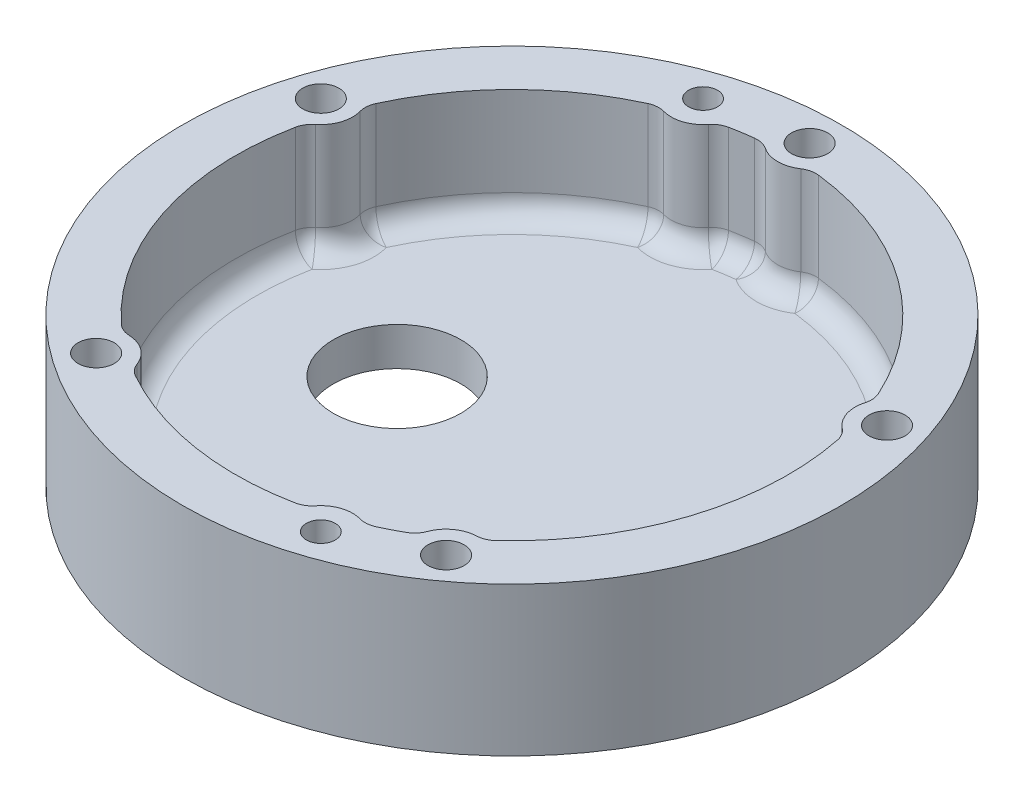
from build123d import *

# Parameters (mm, degrees)
SKETCH_1_R                = 77.5
EXTRUDE_1_DEPTH           = 35
HOLE_WIZARD_1_D           = 8.5
HOLE_WIZARD_1_CBORE_D     = 14
HOLE_WIZARD_1_CBORE_DEPTH = 9
PATTERN_CIRCULAR_1_COUNT  = 5
HOLE_WIZARD_M8_1_D        = 6.8
PATTERN_CIRCULAR_2_COUNT  = 2
CUT_EXTRUDE_1_DEPTH       = 26
FILLET_1_R                = 5
SKETCH_7_R                = 15
CUT_EXTRUDE_2_DEPTH       = 113.643242302


with BuildPart() as part:
    # 草图1 → 凸台-拉伸1 (new body)
    with BuildSketch(Plane(origin=(0, 0, 0), x_dir=(1, 0, 0), z_dir=(0, 1, 0))):
        with Locations(Location((0, 0, 0), (0, 0, 270))):
            Circle(SKETCH_1_R)
    extrude(amount=EXTRUDE_1_DEPTH)

    # 孔1 (through all)
    with Locations(Plane.XZ):
        with Locations((0, -70)):
            hole_wizard_1 = CounterBoreHole(HOLE_WIZARD_1_D / 2, HOLE_WIZARD_1_CBORE_D / 2, HOLE_WIZARD_1_CBORE_DEPTH)

    # 阵列(圆周)1: 孔1 ×5 about axis
    pattern_circular_1_axis = Axis((0, 0, 0), (0, 1, 0))
    for i in range(1, PATTERN_CIRCULAR_1_COUNT):
        add(hole_wizard_1.rotate(pattern_circular_1_axis, i * 360 / PATTERN_CIRCULAR_1_COUNT), mode=Mode.SUBTRACT)

    # M8 螺纹孔1 (through all)
    with Locations(Plane(origin=(0, 35, 0), x_dir=(1, 0, 0), z_dir=(0, 1, 0))):
        with Locations((-21.631189606, 66.573956141)):
            hole_wizard_m8_1 = Hole(HOLE_WIZARD_M8_1_D / 2)

    # 阵列(圆周)2: M8 螺纹孔1 ×2 about axis
    pattern_circular_2_axis = Axis((0, 0, 0), (0, 1, 0))
    for i in range(1, PATTERN_CIRCULAR_2_COUNT):
        add(hole_wizard_m8_1.rotate(pattern_circular_2_axis, i * 360 / PATTERN_CIRCULAR_2_COUNT), mode=Mode.SUBTRACT)

    # 草图6 → 切除-拉伸1 (cut)
    with BuildSketch(Plane(origin=(0, 35, 0), x_dir=(1, 0, 0), z_dir=(0, 1, 0))):
        with BuildLine():
            ThreePointArc((59.943194163, 25.135900093), (38.206041399, 52.586104634), (5.382195883, 64.776785714))
            ThreePointArc((5.382195883, 64.776785714), (0, 62.5), (-5.382195883, 64.776785714))
            ThreePointArc((-5.382195883, 64.776785714), (-10.168240228, 64.199742139), (-14.89835516, 63.269574153))
            ThreePointArc((-14.89835516, 63.269574153), (-19.313562148, 59.441032268), (-25.135900093, 59.943194163))
            ThreePointArc((-25.135900093, 59.943194163), (-45.961940777, 45.961940777), (-59.943194163, 25.135900093))
            ThreePointArc((-59.943194163, 25.135900093), (-59.441032268, 19.313562148), (-63.269574153, 14.89835516))
            ThreePointArc((-63.269574153, 14.89835516), (-61.818673559, -20.086104634), (-42.42912727, -49.241945119))
            ThreePointArc((-42.42912727, -49.241945119), (-36.736578268, -50.563562148), (-33.720551397, -55.569095849))
            ThreePointArc((-33.720551397, -55.569095849), (-10.168240228, -64.199742139), (14.89835516, -63.269574153))
            ThreePointArc((14.89835516, -63.269574153), (19.313562148, -59.441032268), (25.135900093, -59.943194163))
            ThreePointArc((25.135900093, -59.943194163), (29.509382483, -57.915424072), (33.720551397, -55.569095849))
            ThreePointArc((33.720551397, -55.569095849), (36.736578268, -50.563562148), (42.42912727, -49.241945119))
            ThreePointArc((42.42912727, -49.241945119), (61.818673559, -20.086104634), (63.269574153, 14.89835516))
            ThreePointArc((63.269574153, 14.89835516), (59.441032268, 19.313562148), (59.943194163, 25.135900093))
        make_face()
    extrude(amount=-CUT_EXTRUDE_1_DEPTH, mode=Mode.SUBTRACT)

    # 圆角1
    fillet_1_edges = [part.edges().sort_by_distance(p)[0] for p in [
        (-45.961940777, 9, -45.961940777),
        (-59.943194163, 22, -25.135900093),
        (-19.313562148, 9, -59.441032268),
        (-25.135900093, 22, -59.943194163),
        (-10.168240228, 9, -64.199742139),
        (-14.89835516, 22, -63.269574153),
        (0, 9, -62.5),
        (-5.382195883, 22, -64.776785714),
        (38.206041399, 9, -52.586104634),
        (5.382195883, 22, -64.776785714),
        (59.441032268, 9, -19.313562148),
        (59.943194163, 22, -25.135900093),
        (61.818673559, 9, 20.086104634),
        (63.269574153, 22, -14.89835516),
        (36.736578268, 9, 50.563562148),
        (42.42912727, 22, 49.241945119),
        (29.509382483, 9, 57.915424072),
        (33.720551397, 22, 55.569095849),
        (19.313562148, 9, 59.441032268),
        (25.135900093, 22, 59.943194163),
        (-10.168240228, 9, 64.199742139),
        (14.89835516, 22, 63.269574153),
        (-36.736578268, 9, 50.563562148),
        (-33.720551397, 22, 55.569095849),
        (-61.818673559, 9, 20.086104634),
        (-42.42912727, 22, 49.241945119),
        (-59.441032268, 9, -19.313562148),
        (-63.269574153, 22, -14.89835516),
    ]]
    fillet(fillet_1_edges, radius=FILLET_1_R)

    # 草图7 → 切除-拉伸2 (cut, through all)
    with BuildSketch(Plane(origin=(0, 9, 0), x_dir=(1, 0, 0), z_dir=(0, 1, 0))):
        with Locations(Location((-27, 0, 0), (0, 0, 270))):
            Circle(SKETCH_7_R)
    extrude(amount=-CUT_EXTRUDE_2_DEPTH, mode=Mode.SUBTRACT)


solid = part.part
